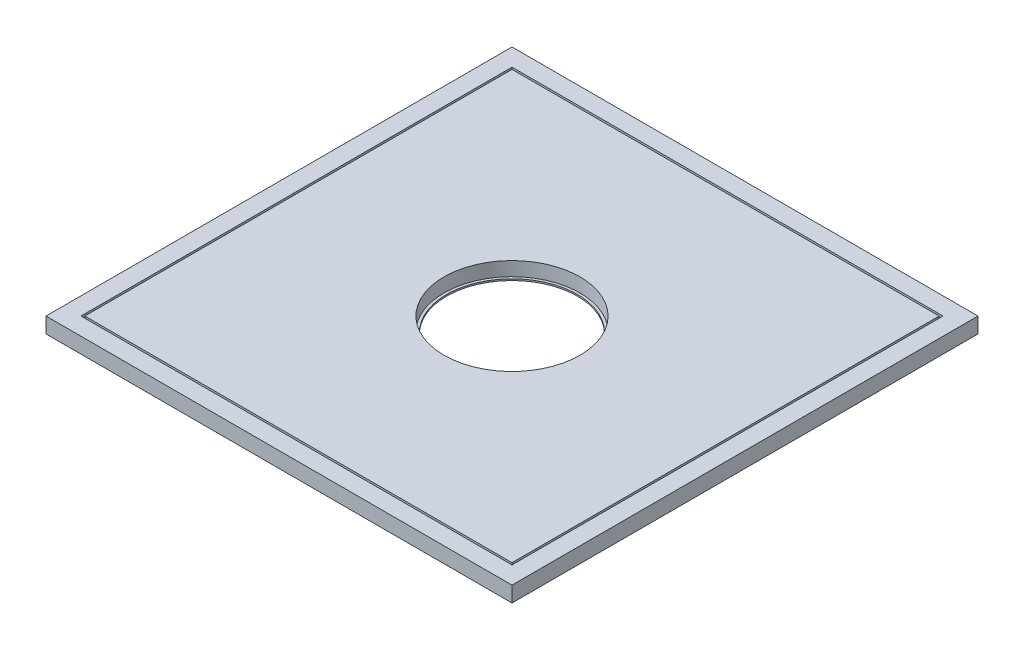
from build123d import *

# Parameters (mm, degrees)
SKETCH1_W          = 600
SKETCH1_H          = 600
PLATE_DEPTH        = 20
SKETCH2_R          = 87.5
BEARING_HOLE_DEPTH = 18
SKETCH3_R          = 84.25
CUT_EXTRUDE2_DEPTH = 18
SKETCH4_W          = 555
SKETCH4_H          = 555
SKETCH4_W_2        = 550
SKETCH4_H_2        = 550
CUT_EXTRUDE3_DEPTH = 10


with BuildPart() as part:
    # Sketch1 → plate (new body)
    with BuildSketch(Plane(origin=(0, 0, 0), x_dir=(1, 0, 0), z_dir=(0, 1, 0))):
        Rectangle(SKETCH1_W, SKETCH1_H)
    extrude(amount=PLATE_DEPTH)

    # Sketch2 → bearing-hole (cut)
    with BuildSketch(Plane(origin=(0, 20, 0), x_dir=(1, 0, 0), z_dir=(0, 1, 0))):
        with Locations(Location((0, 0, 0), (0, 0, 270))):
            Circle(SKETCH2_R)
    extrude(amount=-BEARING_HOLE_DEPTH, mode=Mode.SUBTRACT)

    # Sketch3 → Cut-Extrude2 (cut)
    with BuildSketch(Plane(origin=(0, 2, 0), x_dir=(1, 0, 0), z_dir=(0, 1, 0))):
        with Locations(Location((0, 0, 0), (0, 0, 270))):
            Circle(SKETCH3_R)
    extrude(amount=-CUT_EXTRUDE2_DEPTH, mode=Mode.SUBTRACT)

    # Sketch4 → Cut-Extrude3 (cut)
    with BuildSketch(Plane(origin=(0, 20, 0), x_dir=(1, 0, 0), z_dir=(0, 1, 0))):
        Rectangle(SKETCH4_W, SKETCH4_H)
        Rectangle(SKETCH4_W_2, SKETCH4_H_2, mode=Mode.SUBTRACT)
    extrude(amount=-CUT_EXTRUDE3_DEPTH, mode=Mode.SUBTRACT)


solid = part.part
